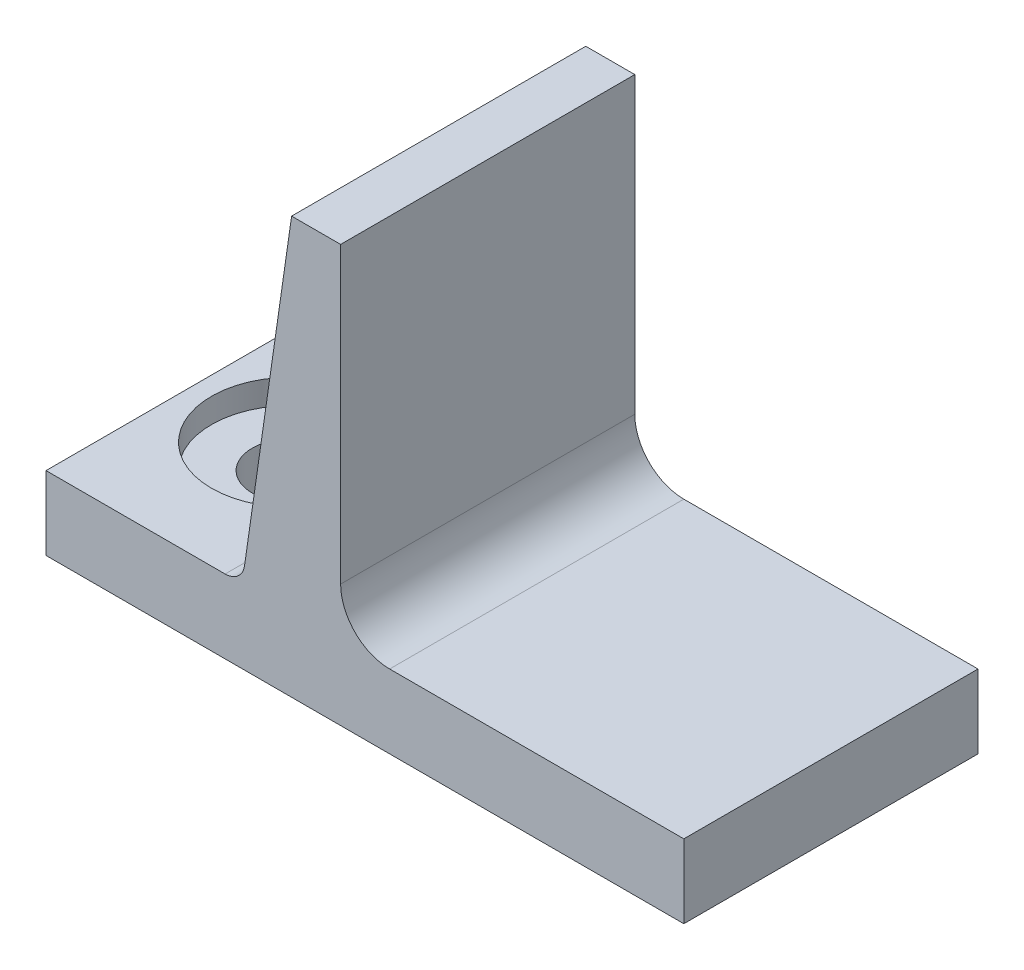
from build123d import *

# Parameters (mm, degrees)
BOSS_EXTRUDE1_DEPTH                                  = 38.1
CBORE_FOR_3_8_BINDING_HEAD_MACHINE_SCREW_D           = 10.0838
CBORE_FOR_3_8_BINDING_HEAD_MACHINE_SCREW_CBORE_D     = 20.6375
CBORE_FOR_3_8_BINDING_HEAD_MACHINE_SCREW_CBORE_DEPTH = 3.175
FILLET1_R                                            = 2.54
FILLET2_R                                            = 6.35


with BuildPart() as part:
    # Sketch1 → Boss-Extrude1 (new body)
    with BuildSketch(Plane.XY):
        Polygon((0, 0), (44.45, 0), (44.45, -9.525), (-38.1608076, -9.525), (-38.1608076, 0), (-12.7608076, 0), (-6.35, 44.45), (0, 44.45), align=None)
    extrude(amount=BOSS_EXTRUDE1_DEPTH)

    # CBORE for 3/8 Binding Head Machine Screw1 (through all)
    with Locations(Plane(origin=(0, 0, 0), x_dir=(1, 0, 0), z_dir=(0, 1, 0))):
        with Locations((-25.4608076, -19.05)):
            CounterBoreHole(CBORE_FOR_3_8_BINDING_HEAD_MACHINE_SCREW_D / 2, CBORE_FOR_3_8_BINDING_HEAD_MACHINE_SCREW_CBORE_D / 2, CBORE_FOR_3_8_BINDING_HEAD_MACHINE_SCREW_CBORE_DEPTH)

    # Fillet1
    fillet1_edges = [part.edges().sort_by_distance(p)[0] for p in [
        (-12.7608076, 0, 19.05),
    ]]
    fillet(fillet1_edges, radius=FILLET1_R)

    # Fillet2
    fillet2_edges = [part.edges().sort_by_distance(p)[0] for p in [
        (0, 0, 19.05),
    ]]
    fillet(fillet2_edges, radius=FILLET2_R)


solid = part.part
